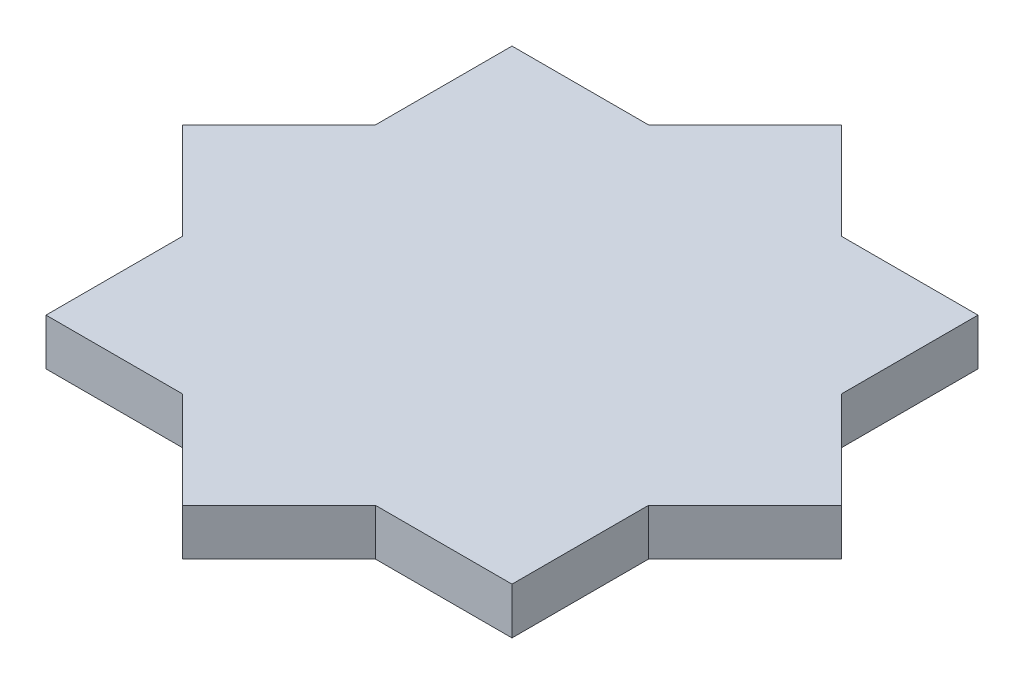
from build123d import *

# Parameters (mm, degrees)
EXTRUDE_1_DEPTH = 3
SKETCH_2_W      = 30
SKETCH_2_H      = 30
EXTRUDE_2_DEPTH = 3


with BuildPart() as part:
    # 草图1 → 凸台-拉伸1 (new body)
    with BuildSketch(Plane(origin=(0, 0, 0), x_dir=(1, 0, 0), z_dir=(0, 1, 0))):
        Polygon((-21.213203436, 0), (0, -21.213203436), (21.213203436, 0), (0, 21.213203436), align=None)
    extrude(amount=EXTRUDE_1_DEPTH)

    # 草图2 → 凸台-拉伸2 (add)
    with BuildSketch(Plane(origin=(0, 0, 0), x_dir=(1, 0, 0), z_dir=(0, 1, 0))):
        Rectangle(SKETCH_2_W, SKETCH_2_H)
    extrude(amount=EXTRUDE_2_DEPTH)


solid = part.part
